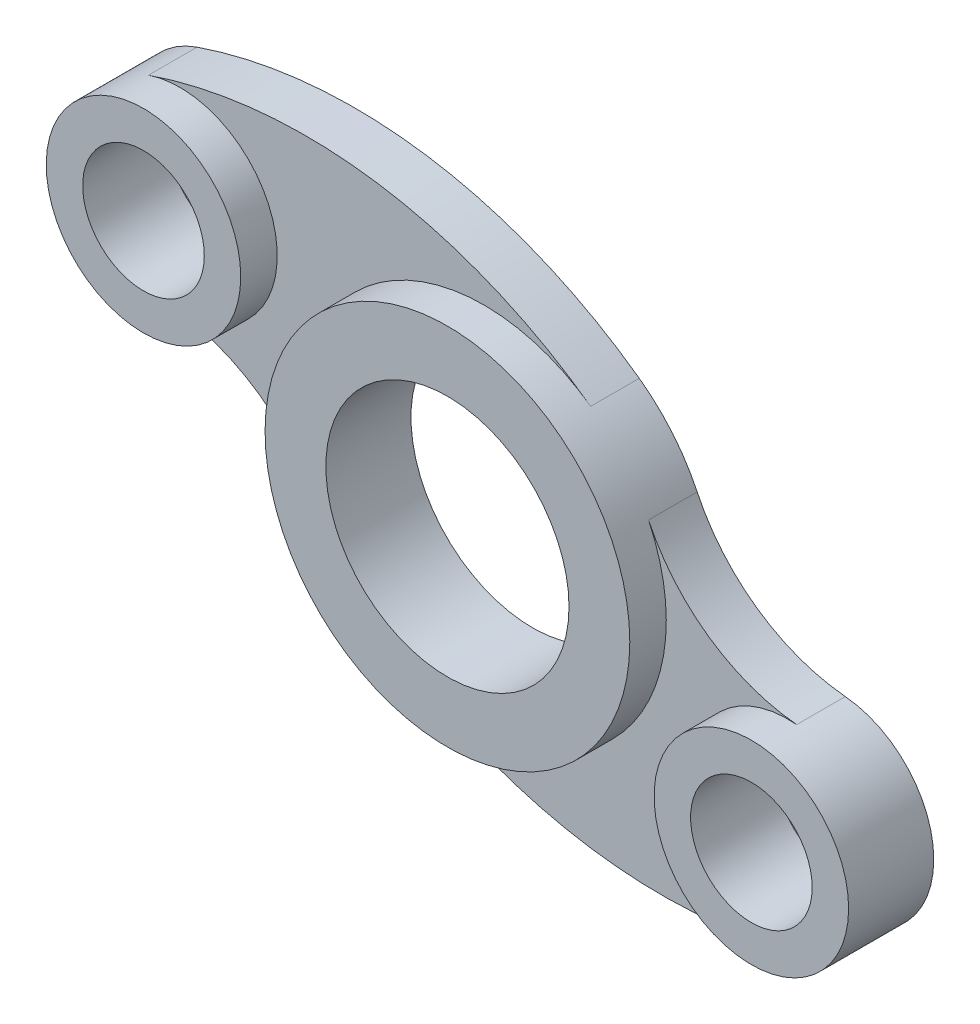
from build123d import *

# Parameters (mm, degrees)
SCHIZZO1_R                     = 30
SCHIZZO1_R_2                   = 20
ESTRUSIONE_ESTRUSIONE1_DEPTH   = 14
SCHIZZO1_R_3                   = 16
SCHIZZO1_R_4                   = 10
ESTRUSIONE_ESTRUSIONE1_2_DEPTH = 14
ESTRUSIONE_ESTRUSIONE1_3_DEPTH = 14
ESTRUSIONE_ESTRUSIONE2_DEPTH   = 8


with BuildPart() as part:
    # Schizzo1 → Estrusione-Estrusione1 (new body)
    with BuildSketch(Plane.XY):
        Circle(SCHIZZO1_R)
        Circle(SCHIZZO1_R_2, mode=Mode.SUBTRACT)
    extrude(amount=ESTRUSIONE_ESTRUSIONE1_DEPTH)



with BuildPart() as body_2:
    # Schizzo1 → Estrusione-Estrusione1 2 (new body)
    with BuildSketch(Plane.XY):
        with Locations((50, -20)):
            Circle(SCHIZZO1_R_3)
        with Locations((50, -20)):
            Circle(SCHIZZO1_R_4, mode=Mode.SUBTRACT)
    extrude(amount=ESTRUSIONE_ESTRUSIONE1_2_DEPTH)


with BuildPart() as body_3:
    # Schizzo1 → Estrusione-Estrusione1 3 (new body)
    with BuildSketch(Plane.XY):
        with Locations((-50, 20)):
            Circle(SCHIZZO1_R_3)
        with Locations((-50, 20)):
            Circle(SCHIZZO1_R_4, mode=Mode.SUBTRACT)
    extrude(amount=ESTRUSIONE_ESTRUSIONE1_3_DEPTH)


with BuildPart() as part_1:
    add(part.part)

    add(body_2.part)  # Estrusione-Estrusione2 merges body 2

    add(body_3.part)  # Estrusione-Estrusione2 merges body 3
    # Schizzo1<3> → Estrusione-Estrusione2 (add)
    with BuildSketch(Plane.XY):
        with BuildLine():
            ThreePointArc((27.082221172, 12.905552929), (19.216285693, -23.037672716), (-17.554966307, -24.327415768))
            ThreePointArc((-17.554966307, -24.327415768), (17.499627211, -38.585427044), (55.185430705, -35.136423237))
            ThreePointArc((55.185430705, -35.136423237), (34.114481769, -21.910578587), (51.448501685, -4.06570231))
            ThreePointArc((51.448501685, -4.06570231), (37.018349838, 1.193804792), (27.082221172, 12.905552929))
        make_face()
        with BuildLine():
            ThreePointArc((-27.082221172, -12.905552929), (-19.216285693, 23.037672716), (17.554966307, 24.327415768))
            ThreePointArc((17.554966307, 24.327415768), (-17.499627211, 38.585427044), (-55.185430705, 35.136423237))
            ThreePointArc((-55.185430705, 35.136423237), (-34.114481769, 21.910578587), (-51.448501685, 4.06570231))
            ThreePointArc((-51.448501685, 4.06570231), (-37.018349838, -1.193804792), (-27.082221172, -12.905552929))
        make_face()
    extrude(amount=ESTRUSIONE_ESTRUSIONE2_DEPTH)


solid = part_1.part
